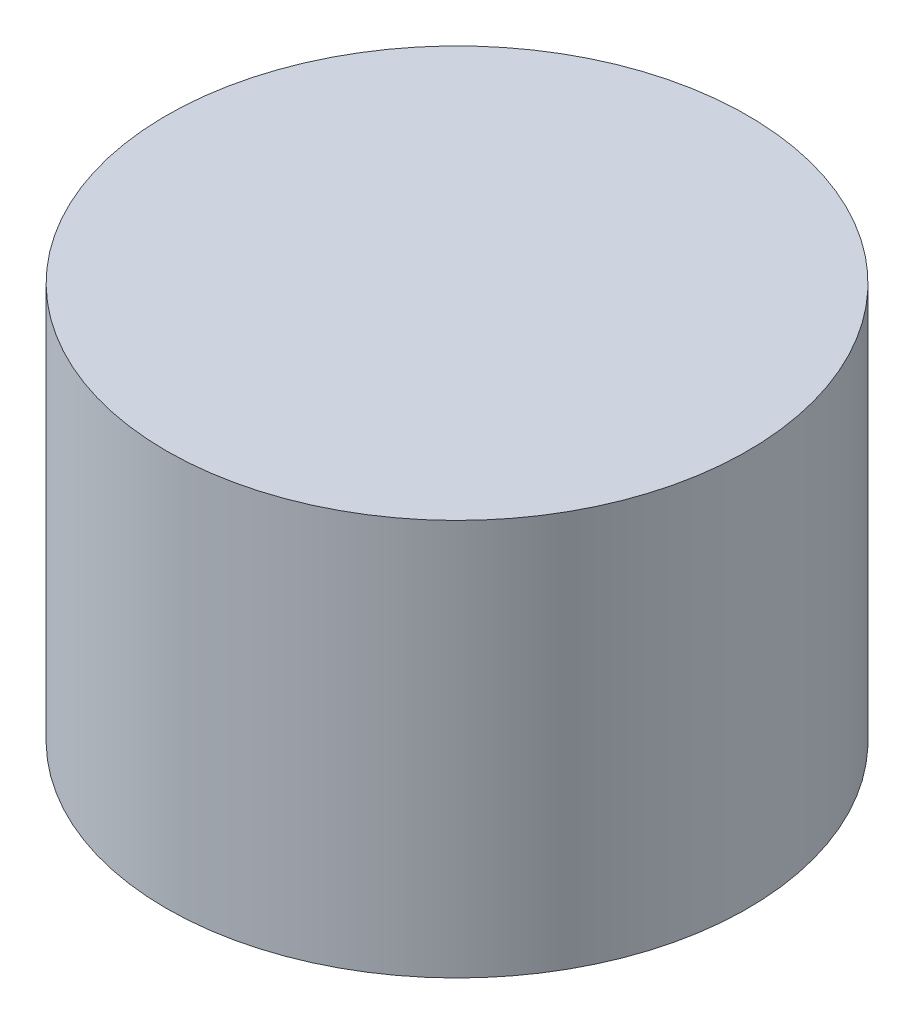
from build123d import *

# Parameters (mm, degrees)
SKETCH1_R           = 2.2
SKETCH1_R_2         = 1.2
BOSS_EXTRUDE1_DEPTH = 1.5
SKETCH2_R           = 2.2
BOSS_EXTRUDE2_DEPTH = 1.5


with BuildPart() as part:
    # Sketch1 → Boss-Extrude1 (new body)
    with BuildSketch(Plane(origin=(0, 0, 0), x_dir=(1, 0, 0), z_dir=(0, 1, 0))):
        with Locations(Location((0, 0, 0), (0, 0, 270))):
            Circle(SKETCH1_R)
        with Locations(Location((0, 0, 0), (0, 0, 270))):
            Circle(SKETCH1_R_2, mode=Mode.SUBTRACT)
    extrude(amount=BOSS_EXTRUDE1_DEPTH)

    # Sketch2 → Boss-Extrude2 (add)
    with BuildSketch(Plane(origin=(0, 1.5, 0), x_dir=(1, 0, 0), z_dir=(0, 1, 0))):
        with Locations(Location((0, 0, 0), (0, 0, 270))):
            Circle(SKETCH2_R)
    extrude(amount=BOSS_EXTRUDE2_DEPTH)


solid = part.part
